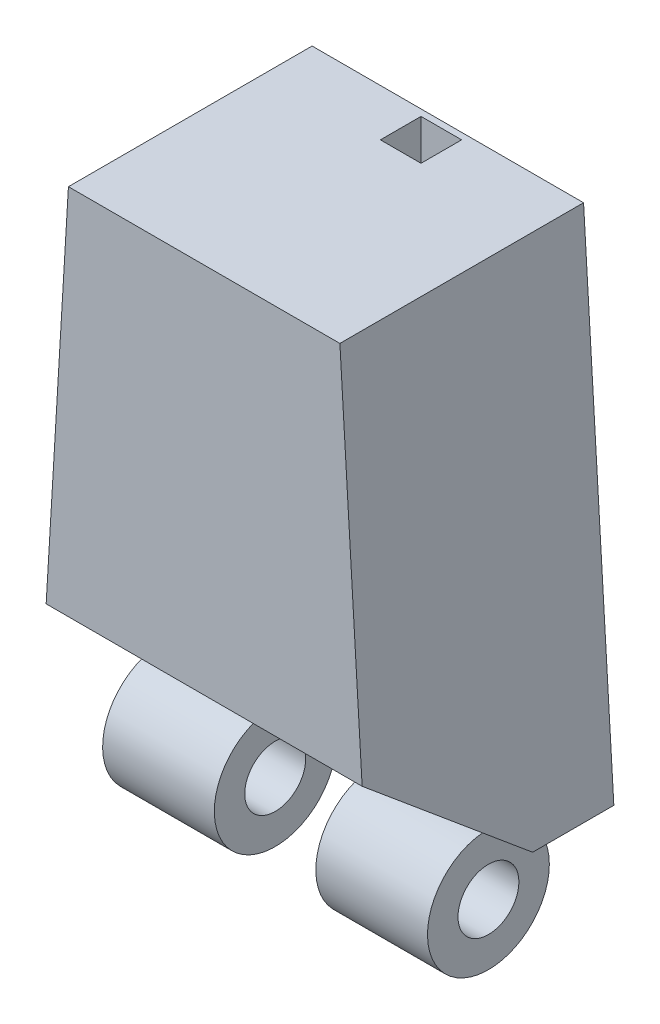
from build123d import *

# Parameters (mm, degrees)
BOSS_EXTRUDE1_DEPTH     = 12
CUT_EXTRUDE1_DEPTH      = 35.812889373
CUT_EXTRUDE1_DEPTH_BACK = 35.812889373
SKETCH6_R               = 3
SKETCH6_R_2             = 1.5
BOSS_EXTRUDE2_DEPTH     = 8
SKETCH6_3_R             = 3
SKETCH6_3_R_2           = 1.5
CUT_EXTRUDE2_DEPTH      = 2.5
CUT_EXTRUDE3_DEPTH      = 5
SKETCH8_R               = 1.5
BOSS_EXTRUDE3_DEPTH     = 5.5
CUT_EXTRUDE4_DEPTH      = 35.812889373
CUT_EXTRUDE4_DEPTH_BACK = 35.812889373
SKETCH9_W               = 12
SKETCH9_H               = 6.684402113
SKETCH10_W              = 2
SKETCH10_H              = 28.550384588
CUT_EXTRUDE5_DEPTH      = 1


with BuildPart() as part:
    # Sketch1 → Boss-Extrude1 (new body)
    with BuildSketch(Plane.XY):
        with BuildLine():
            Line((-56.5742778, 0), (-40.220810234, 0))
            Line((-40.220810234, 0), (-41.713141903, 24.955419175))
            ThreePointArc((-41.713141903, 24.955419175), (-48.397544017, 31.639821288), (-55.081946131, 24.955419175))
            Line((-55.081946131, 24.955419175), (-56.5742778, 0))
        make_face()
    extrude(amount=BOSS_EXTRUDE1_DEPTH)

    # Sketch3 → Cut-Extrude1 (cut, two sides: drawn at the far end of the back side and taken through both)
    with BuildSketch(Plane(origin=(-48.397544017, 0, 0), x_dir=(0, 0, -1), z_dir=(1, 0, 0)).offset(-CUT_EXTRUDE1_DEPTH_BACK)):
        Polygon((-12, 0), (-4, 0), (-12, 6.613954944), align=None)
    extrude(amount=CUT_EXTRUDE1_DEPTH + CUT_EXTRUDE1_DEPTH_BACK, mode=Mode.SUBTRACT)

    # Sketch6 → Boss-Extrude2 (add, symmetric)
    with BuildSketch(Plane(origin=(-48.397544017, 0, 0), x_dir=(0, 0, -1), z_dir=(1, 0, 0))):
        with Locations((-6, -1.1)):
            Circle(SKETCH6_R)
        with Locations((-6, -1.1)):
            Circle(SKETCH6_R_2, mode=Mode.SUBTRACT)
    extrude(amount=BOSS_EXTRUDE2_DEPTH, both=True)

    # Sketch6<3> → Cut-Extrude2 (cut, symmetric)
    with BuildSketch(Plane(origin=(-48.397544017, 0, 0), x_dir=(0, 0, -1), z_dir=(1, 0, 0))):
        with Locations((-6, -1.1)):
            Circle(SKETCH6_3_R)
        with Locations((-6, -1.1)):
            Circle(SKETCH6_3_R_2, mode=Mode.SUBTRACT)
    extrude(amount=CUT_EXTRUDE2_DEPTH, both=True, mode=Mode.SUBTRACT)

    # Sketch7 → Cut-Extrude3 (cut, symmetric)
    with BuildSketch(Plane(origin=(-48.397544017, 0, 0), x_dir=(0, 0, -1), z_dir=(1, 0, 0))):
        Polygon((-7.161655697, 2.613881041), (-11.015220244, 5.799793827), (-7.829307458, 9.653358374), (-3.975742911, 6.467445588), align=None)
    extrude(amount=CUT_EXTRUDE3_DEPTH, both=True, mode=Mode.SUBTRACT)

    # Sketch8 → Boss-Extrude3 (add, symmetric)
    with BuildSketch(Plane(origin=(-48.397544017, 0, 0), x_dir=(0, 0, -1), z_dir=(1, 0, 0))):
        with Locations((-7.548090256, 6.177113636)):
            Circle(SKETCH8_R)
    extrude(amount=BOSS_EXTRUDE3_DEPTH, both=True)

    # Sketch9 → Cut-Extrude4 (cut, two sides: drawn at the far end of the back side and taken through both)
    with BuildSketch(Plane(origin=(-48.397544017, 0, 0), x_dir=(0, 0, -1), z_dir=(1, 0, 0)).offset(-CUT_EXTRUDE4_DEPTH_BACK)):
        with Locations((-6, 28.297620232)):
            Rectangle(SKETCH9_W, SKETCH9_H)
    extrude(amount=CUT_EXTRUDE4_DEPTH + CUT_EXTRUDE4_DEPTH_BACK, mode=Mode.SUBTRACT)

    # Sketch10 → Cut-Extrude5 (cut, symmetric)
    with BuildSketch(Plane(origin=(-48.397544017, 0, 0), x_dir=(0, 0, -1), z_dir=(1, 0, 0))):
        with Locations((-1.32, 14.275192294)):
            Rectangle(SKETCH10_W, SKETCH10_H)
    extrude(amount=CUT_EXTRUDE5_DEPTH, both=True, mode=Mode.SUBTRACT)


solid = part.part
